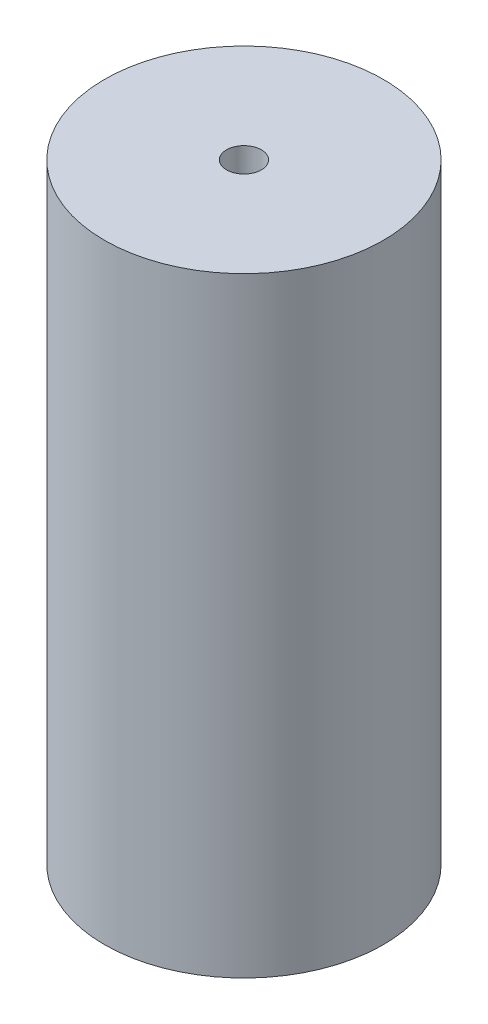
from build123d import *

# Parameters (mm, degrees)
SKETCH_1_R      = 40
SKETCH_1_R_2    = 5
EXTRUDE_1_DEPTH = 175


with BuildPart() as part:
    # 草图1 → 凸台-拉伸1 (new body)
    with BuildSketch(Plane(origin=(0, 0, 0), x_dir=(1, 0, 0), z_dir=(0, 1, 0))):
        with Locations(Location((0, 0, 0), (0, 0, 270))):
            Circle(SKETCH_1_R)
        with Locations(Location((0, 0, 0), (0, 0, 270))):
            Circle(SKETCH_1_R_2, mode=Mode.SUBTRACT)
    extrude(amount=EXTRUDE_1_DEPTH)


solid = part.part
